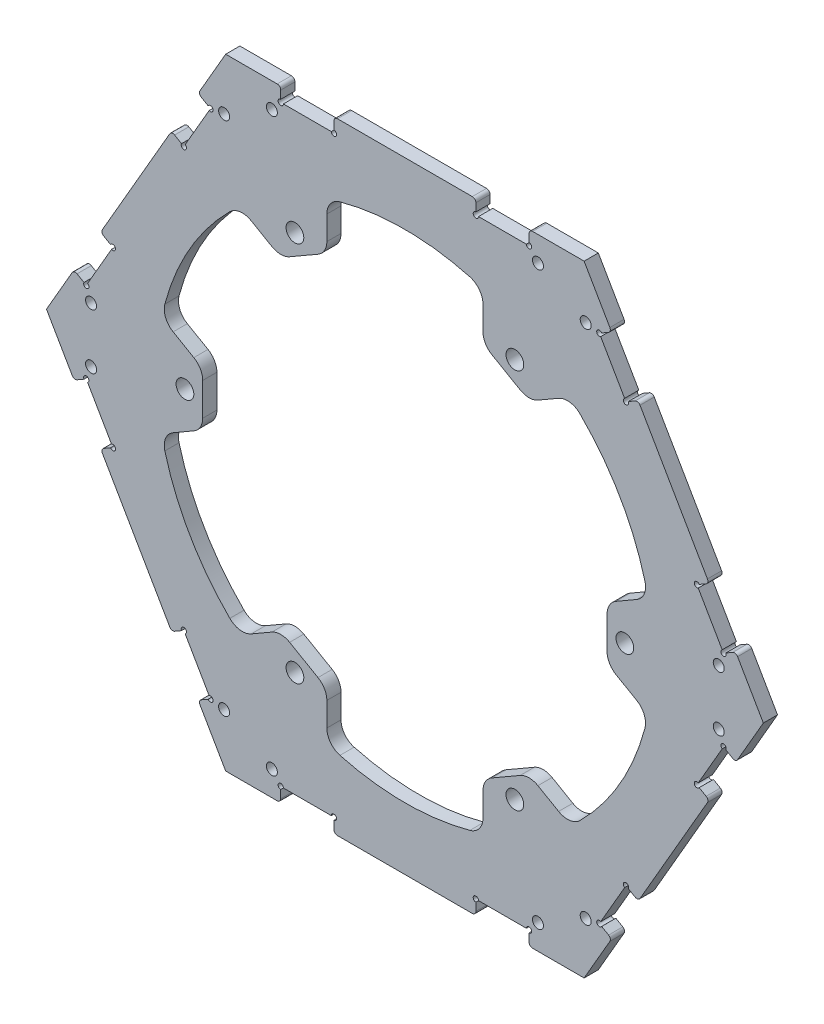
from build123d import *

# Parameters (mm, degrees)
SKETCH80_R           = 2.5
BOSS_EXTRUDE22_DEPTH = 4
SKETCH88_R           = 1.55
SKETCH88_W           = 15
SKETCH88_H           = 4
CUT_EXTRUDE1_DEPTH   = 142.352691284
SKETCH89_R           = 0.75
CUT_EXTRUDE2_DEPTH   = 142.352691284
CUT_EXTRUDE6_DEPTH   = 142.352691284
FILLET1_R            = 1
FILLET2_R            = 5


with BuildPart() as part:
    # Sketch80 → Boss-Extrude22 (new body)
    with BuildSketch(Plane(origin=(0, 0, 0), x_dir=(-1, 0, 0), z_dir=(0, 0, -1))):
        Polygon((106.8097998, 0), (53.4048999, 92.5), (-53.4048999, 92.5), (-106.8097998, 0), (-53.4048999, -92.5), (53.4048999, -92.5), align=None)
        with Locations((-62, 0)):
            Circle(SKETCH80_R, mode=Mode.SUBTRACT)
        with Locations((-31, 53.693575035)):
            Circle(SKETCH80_R, mode=Mode.SUBTRACT)
        with Locations((31, 53.693575035)):
            Circle(SKETCH80_R, mode=Mode.SUBTRACT)
        with Locations((62, 0)):
            Circle(SKETCH80_R, mode=Mode.SUBTRACT)
        with Locations((31, -53.693575035)):
            Circle(SKETCH80_R, mode=Mode.SUBTRACT)
        with Locations((-31, -53.693575035)):
            Circle(SKETCH80_R, mode=Mode.SUBTRACT)
        with BuildLine():
            Line((-68.551003938, 14.168975233), (-57, 7.5))
            Line((-57, 7.5), (-57, -7.5))
            Line((-57, -7.5), (-68.551003938, -14.168975233))
            ThreePointArc((-68.551003938, -14.168975233), (-60.621778265, -35), (-46.546194466, -52.282423248))
            Line((-46.546194466, -52.282423248), (-34.995190528, -45.613448016))
            Line((-34.995190528, -45.613448016), (-22.004809472, -53.113448016))
            Line((-22.004809472, -53.113448016), (-22.004809472, -66.451398481))
            ThreePointArc((-22.004809472, -66.451398481), (0, -70), (22.004809472, -66.451398481))
            Line((22.004809472, -66.451398481), (22.004809472, -53.113448016))
            Line((22.004809472, -53.113448016), (34.995190528, -45.613448016))
            Line((34.995190528, -45.613448016), (46.546194466, -52.282423248))
            ThreePointArc((46.546194466, -52.282423248), (60.621778265, -35), (68.551003938, -14.168975233))
            Line((68.551003938, -14.168975233), (57, -7.5))
            Line((57, -7.5), (57, 7.5))
            Line((57, 7.5), (68.551003938, 14.168975233))
            ThreePointArc((68.551003938, 14.168975233), (60.621778265, 35), (46.546194466, 52.282423248))
            Line((46.546194466, 52.282423248), (34.995190528, 45.613448016))
            Line((34.995190528, 45.613448016), (22.004809472, 53.113448016))
            Line((22.004809472, 53.113448016), (22.004809472, 66.451398481))
            ThreePointArc((22.004809472, 66.451398481), (0, 70), (-22.004809472, 66.451398481))
            Line((-22.004809472, 66.451398481), (-22.004809472, 53.113448016))
            Line((-22.004809472, 53.113448016), (-34.995190528, 45.613448016))
            Line((-34.995190528, 45.613448016), (-46.546194466, 52.282423248))
            ThreePointArc((-46.546194466, 52.282423248), (-60.621778265, 35), (-68.551003938, 14.168975233))
        make_face(mode=Mode.SUBTRACT)
    extrude(amount=BOSS_EXTRUDE22_DEPTH)

    # Sketch88 → Cut-Extrude1 (cut, through all)
    with BuildSketch(Plane(origin=(0, 0, -4), x_dir=(-1, 0, 0), z_dir=(0, 0, -1))):
        with Locations((-37.5, 80.5)):
            Circle(SKETCH88_R)
        with Locations((37.5, 80.5)):
            Circle(SKETCH88_R)
        with Locations((50.965045005, 72.725952642)):
            Circle(SKETCH88_R)
        with Locations((88.465045005, 7.774047358)):
            Circle(SKETCH88_R)
        with Locations((88.465045005, -7.774047358)):
            Circle(SKETCH88_R)
        with Locations((50.965045005, -72.725952642)):
            Circle(SKETCH88_R)
        with Locations((37.5, -80.5)):
            Circle(SKETCH88_R)
        with Locations((-37.5, -80.5)):
            Circle(SKETCH88_R)
        with Locations((-50.965045005, -72.725952642)):
            Circle(SKETCH88_R)
        with Locations((-88.465045005, -7.774047358)):
            Circle(SKETCH88_R)
        with Locations((-88.465045005, 7.774047358)):
            Circle(SKETCH88_R)
        with Locations((-50.965045005, 72.725952642)):
            Circle(SKETCH88_R)
        with Locations((27.5, 85.5)):
            Rectangle(SKETCH88_W, SKETCH88_H)
        with Locations((-27.5, 85.5)):
            Rectangle(SKETCH88_W, SKETCH88_H)
        Polygon((62.313121216, 59.070508076), (54.813121216, 72.060889132), (58.277222831, 74.060889132), (65.777222831, 61.070508076), align=None)
        Polygon((85.777222831, 26.429491924), (82.313121216, 24.429491924), (89.813121216, 11.439110868), (93.277222831, 13.439110868), align=None)
        Polygon((82.313121216, -24.429491924), (89.813121216, -11.439110868), (93.277222831, -13.439110868), (85.777222831, -26.429491924), align=None)
        Polygon((65.777222831, -61.070508076), (62.313121216, -59.070508076), (54.813121216, -72.060889132), (58.277222831, -74.060889132), align=None)
        with Locations((27.5, -85.5)):
            Rectangle(SKETCH88_W, SKETCH88_H)
        with Locations((-27.5, -85.5)):
            Rectangle(SKETCH88_W, SKETCH88_H)
        Polygon((-62.313121216, -59.070508076), (-54.813121216, -72.060889132), (-58.277222831, -74.060889132), (-65.777222831, -61.070508076), align=None)
        Polygon((-85.777222831, -26.429491924), (-82.313121216, -24.429491924), (-89.813121216, -11.439110868), (-93.277222831, -13.439110868), align=None)
        Polygon((-82.313121216, 24.429491924), (-89.813121216, 11.439110868), (-93.277222831, 13.439110868), (-85.777222831, 26.429491924), align=None)
        Polygon((-65.777222831, 61.070508076), (-62.313121216, 59.070508076), (-54.813121216, 72.060889132), (-58.277222831, 74.060889132), align=None)
    extrude(amount=-CUT_EXTRUDE1_DEPTH, mode=Mode.SUBTRACT)

    # Sketch89 → Cut-Extrude2 (cut, through all)
    with BuildSketch(Plane(origin=(0, 0, -4), x_dir=(-1, 0, 0), z_dir=(0, 0, -1))):
        with Locations((-35, 83.5)):
            Circle(SKETCH89_R)
        with Locations((-20, 83.5)):
            Circle(SKETCH89_R)
        with Locations((20, 83.5)):
            Circle(SKETCH89_R)
        with Locations((35, 83.5)):
            Circle(SKETCH89_R)
        with Locations((54.813121216, 72.060889132)):
            Circle(SKETCH89_R)
        with Locations((62.313121216, 59.070508076)):
            Circle(SKETCH89_R)
        with Locations((82.313121216, 24.429491924)):
            Circle(SKETCH89_R)
        with Locations((89.813121216, 11.439110868)):
            Circle(SKETCH89_R)
        with Locations((89.813121216, -11.439110868)):
            Circle(SKETCH89_R)
        with Locations((82.313121216, -24.429491924)):
            Circle(SKETCH89_R)
        with Locations((62.313121216, -59.070508076)):
            Circle(SKETCH89_R)
        with Locations((54.813121216, -72.060889132)):
            Circle(SKETCH89_R)
        with Locations((35, -83.5)):
            Circle(SKETCH89_R)
        with Locations((20, -83.5)):
            Circle(SKETCH89_R)
        with Locations((-20, -83.5)):
            Circle(SKETCH89_R)
        with Locations((-35, -83.5)):
            Circle(SKETCH89_R)
        with Locations((-54.813121216, -72.060889132)):
            Circle(SKETCH89_R)
        with Locations((-62.313121216, -59.070508076)):
            Circle(SKETCH89_R)
        with Locations((-82.313121216, -24.429491924)):
            Circle(SKETCH89_R)
        with Locations((-89.813121216, -11.439110868)):
            Circle(SKETCH89_R)
        with Locations((-89.813121216, 11.439110868)):
            Circle(SKETCH89_R)
        with Locations((-82.313121216, 24.429491924)):
            Circle(SKETCH89_R)
        with Locations((-62.313121216, 59.070508076)):
            Circle(SKETCH89_R)
        with Locations((-54.813121216, 72.060889132)):
            Circle(SKETCH89_R)
    extrude(amount=-CUT_EXTRUDE2_DEPTH, mode=Mode.SUBTRACT)

    # Sketch90 → Cut-Extrude6 (cut, through all)
    with BuildSketch(Plane(origin=(0, 0, -4), x_dir=(-1, 0, 0), z_dir=(0, 0, -1))):
        Polygon((-106.8097998, 0), (-53.4048999, -92.5), (53.4048999, -92.5), (106.8097998, 0), (53.4048999, 92.5), (-53.4048999, 92.5), align=None)
        Polygon((-50.518148554, -87.5), (50.518148554, -87.5), (101.036297108, 0), (50.518148554, 87.5), (-50.518148554, 87.5), (-101.036297108, 0), align=None, mode=Mode.SUBTRACT)
    extrude(amount=-CUT_EXTRUDE6_DEPTH, mode=Mode.SUBTRACT)

    # Fillet1
    fillet1_edges = [part.edges().sort_by_distance(p)[0] for p in [
        (85.777222831, 26.429491924, -2),
        (93.277222831, 13.439110868, -2),
        (65.777222831, 61.070508076, -2),
        (58.277222831, 74.060889132, -2),
        (65.777222831, -61.070508076, -2),
        (58.277222831, -74.060889132, -2),
        (85.777222831, -26.429491924, -2),
        (93.277222831, -13.439110868, -2),
        (-20, -87.5, -2),
        (-35, -87.5, -2),
        (20, -87.5, -2),
        (35, -87.5, -2),
        (-85.777222831, -26.429491924, -2),
        (-93.277222831, -13.439110868, -2),
        (-65.777222831, -61.070508076, -2),
        (-58.277222831, -74.060889132, -2),
        (20, 87.5, -2),
        (35, 87.5, -2),
        (-85.777222831, 26.429491924, -2),
        (-93.277222831, 13.439110868, -2),
        (-65.777222831, 61.070508076, -2),
        (-58.277222831, 74.060889132, -2),
        (-20, 87.5, -2),
        (-35, 87.5, -2),
    ]]
    fillet(fillet1_edges, radius=FILLET1_R)

    # Fillet2
    fillet2_edges = [part.edges().sort_by_distance(p)[0] for p in [
        (46.546194466, 52.282423248, -2),
        (68.551003938, 14.168975233, -2),
        (57, 7.5, -2),
        (57, -7.5, -2),
        (68.551003938, -14.168975233, -2),
        (46.546194466, -52.282423248, -2),
        (34.995190528, -45.613448016, -2),
        (22.004809472, -53.113448016, -2),
        (22.004809472, -66.451398481, -2),
        (-22.004809472, -66.451398481, -2),
        (-22.004809472, -53.113448016, -2),
        (-34.995190528, -45.613448016, -2),
        (-46.546194466, -52.282423248, -2),
        (-68.551003938, -14.168975233, -2),
        (-57, -7.5, -2),
        (-57, 7.5, -2),
        (-68.551003938, 14.168975233, -2),
        (-46.546194466, 52.282423248, -2),
        (-34.995190528, 45.613448016, -2),
        (-22.004809472, 53.113448016, -2),
        (-22.004809472, 66.451398481, -2),
        (22.004809472, 66.451398481, -2),
        (22.004809472, 53.113448016, -2),
        (34.995190528, 45.613448016, -2),
    ]]
    fillet(fillet2_edges, radius=FILLET2_R)


solid = part.part
